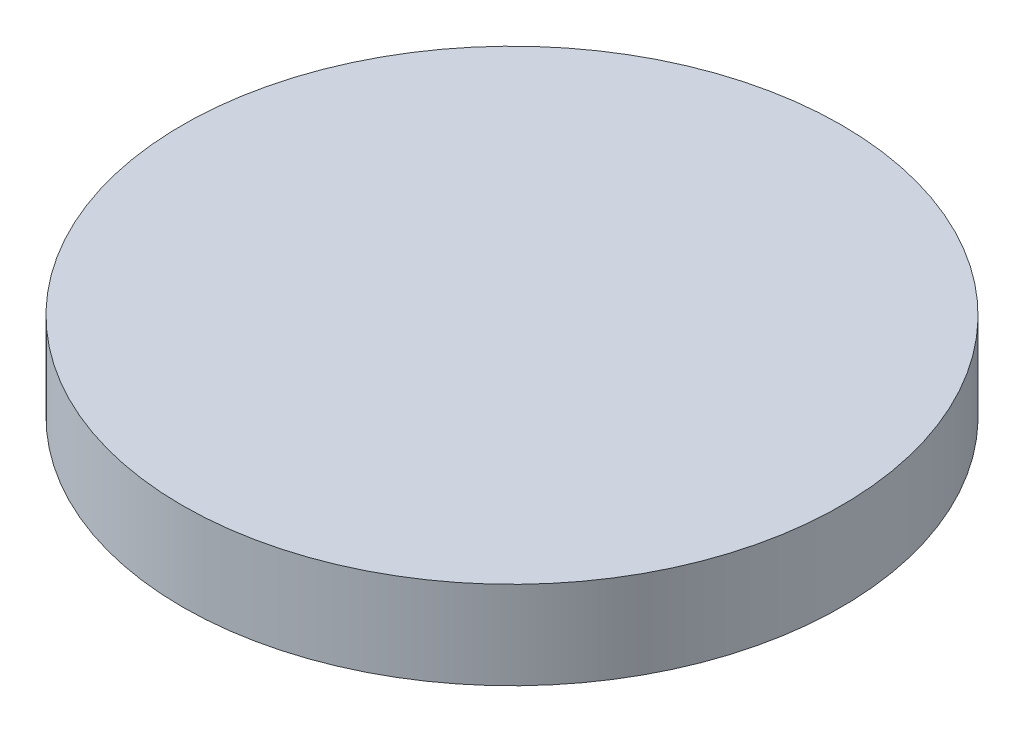
from build123d import *

# Parameters (mm, degrees)
SKETCH1_R           = 7.5
BOSS_EXTRUDE1_DEPTH = 2


with BuildPart() as part:
    # Sketch1 → Boss-Extrude1 (new body)
    with BuildSketch(Plane(origin=(0, 0, 0), x_dir=(1, 0, 0), z_dir=(0, 1, 0))):
        with Locations(Location((0, 0, 0), (0, 0, 270))):
            Circle(SKETCH1_R)
    extrude(amount=BOSS_EXTRUDE1_DEPTH)


solid = part.part
